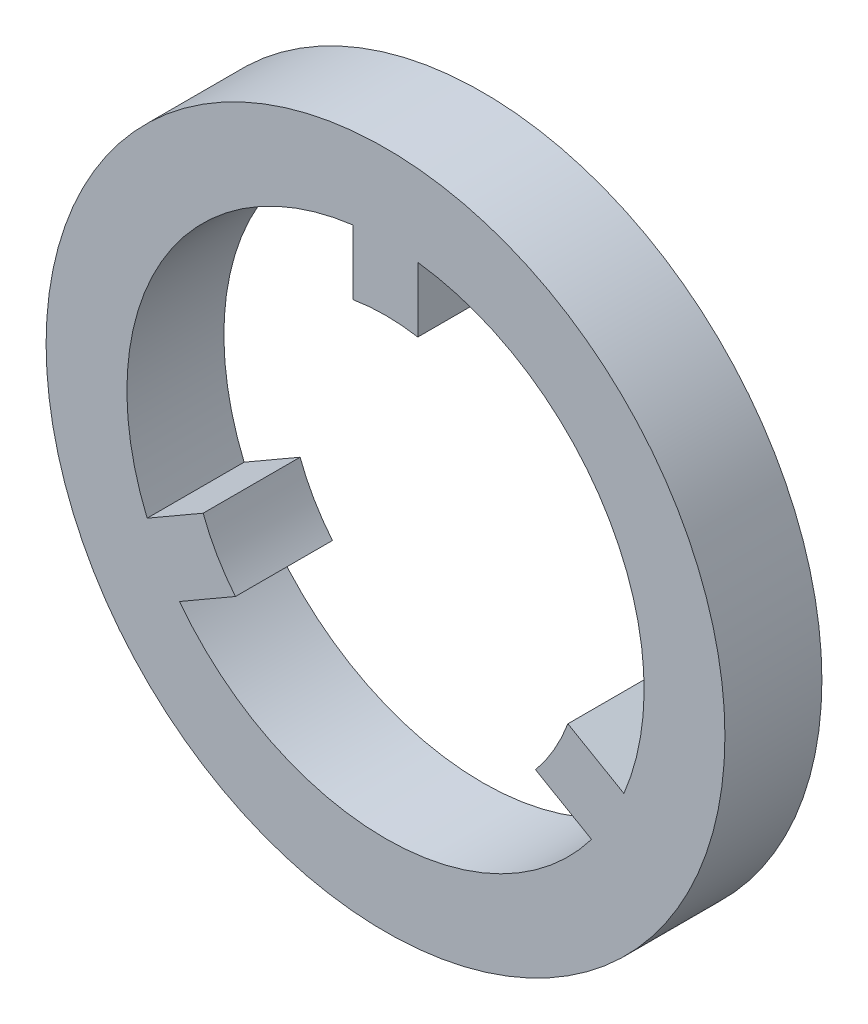
from build123d import *

# Parameters (mm, degrees)
SKETCH1_R           = 10.5
SKETCH1_R_2         = 8
BOSS_EXTRUDE1_DEPTH = 3


with BuildPart() as part:
    # Sketch1 → Boss-Extrude1 (new body)
    # profile 1 of 4: a face of its own
    with BuildSketch(Plane.XY):
        Circle(SKETCH1_R)
        Circle(SKETCH1_R_2, mode=Mode.SUBTRACT)
    # profile 2 of 4: a face of its own
    with BuildSketch(Plane.XY):
        with BuildLine():
            ThreePointArc((1, 7.937253933), (0, 8), (-1, 7.937253933))
            Line((-1, 7.937253933), (-1, 5.937253933))
            ThreePointArc((-1, 5.937253933), (0, 6.020879028), (1, 5.937253933))
            Line((1, 5.937253933), (1, 7.937253933))
        make_face()
    # profile 3 of 4: a face of its own
    with BuildSketch(Plane.XY):
        with BuildLine():
            ThreePointArc((6.373863542, -4.83465237), (6.92820323, -4), (7.373863542, -3.102601563))
            Line((7.373863542, -3.102601563), (5.641812735, -2.102601563))
            ThreePointArc((5.641812735, -2.102601563), (5.214234191, -3.010439514), (4.641812735, -3.83465237))
            Line((4.641812735, -3.83465237), (6.373863542, -4.83465237))
        make_face()
    # profile 4 of 4: a face of its own
    with BuildSketch(Plane.XY):
        with BuildLine():
            Line((-5.641812735, -2.102601563), (-7.373863542, -3.102601563))
            ThreePointArc((-7.373863542, -3.102601563), (-6.92820323, -4), (-6.373863542, -4.83465237))
            Line((-6.373863542, -4.83465237), (-4.641812735, -3.83465237))
            ThreePointArc((-4.641812735, -3.83465237), (-5.214234191, -3.010439514), (-5.641812735, -2.102601563))
        make_face()
    extrude(amount=BOSS_EXTRUDE1_DEPTH)


solid = part.part
